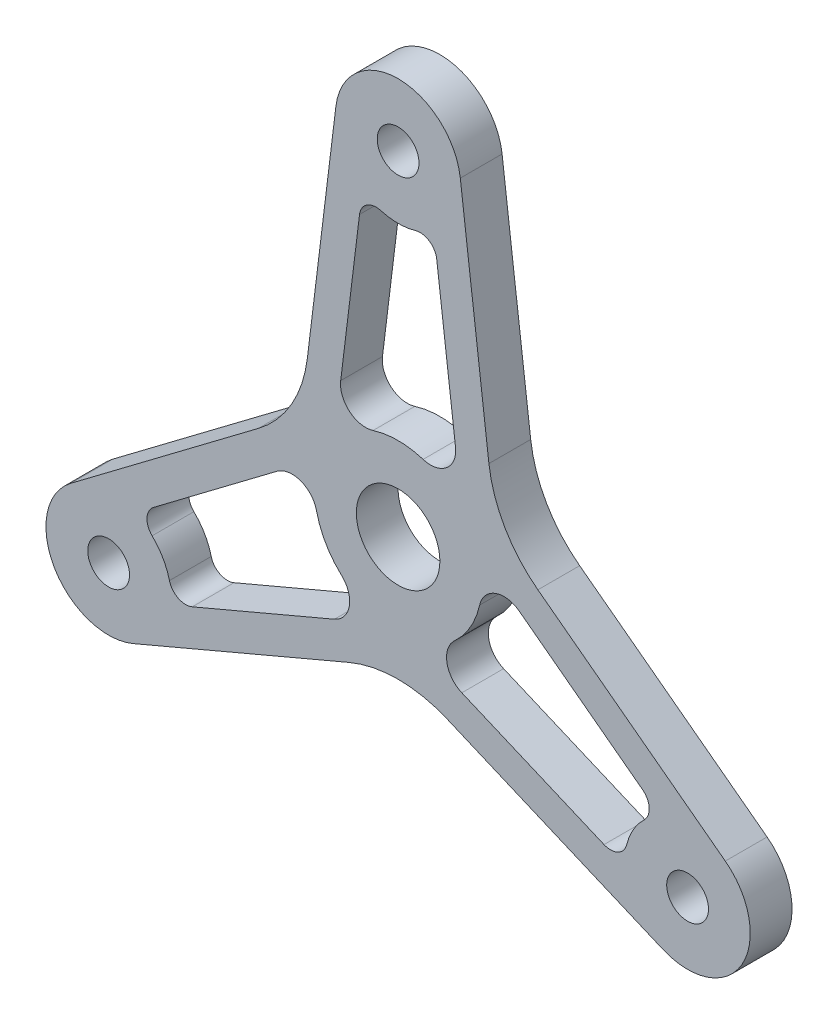
from build123d import *

# Parameters (mm, degrees)
SKETCH1_R           = 5
SKETCH1_R_2         = 10
BOSS_EXTRUDE1_DEPTH = 10


with BuildPart() as part:
    # Sketch1 → Boss-Extrude1 (new body)
    with BuildSketch(Plane.XY):
        with BuildLine():
            ThreePointArc((-33.454782287, 5.779804226), (-25.528470868, 14.738869527), (-21.732848432, 26.082789225))
            Line((-21.732848432, 26.082789225), (-14.888192275, 81.828040151))
            ThreePointArc((-14.888192275, 81.828040151), (0, 95), (14.888192275, 81.828040151))
            Line((14.888192275, 81.828040151), (21.732848432, 26.082789225))
            ThreePointArc((21.732848432, 26.082789225), (25.528470868, 14.738869527), (33.454782287, 5.779804226))
            Line((33.454782287, 5.779804226), (78.30925765, -28.020467349))
            ThreePointArc((78.30925765, -28.020467349), (82.27241336, -47.5), (63.421065375, -53.807572802))
            Line((63.421065375, -53.807572802), (11.721933855, -31.862593451))
            ThreePointArc((11.721933855, -31.862593451), (0, -29.477739055), (-11.721933855, -31.862593451))
            Line((-11.721933855, -31.862593451), (-63.421065375, -53.807572802))
            ThreePointArc((-63.421065375, -53.807572802), (-82.27241336, -47.5), (-78.30925765, -28.020467349))
            Line((-78.30925765, -28.020467349), (-33.454782287, 5.779804226))
        make_face()
        with Locations((-69.282032303, -40)):
            Circle(SKETCH1_R, mode=Mode.SUBTRACT)
        with Locations((69.282032303, -40)):
            Circle(SKETCH1_R, mode=Mode.SUBTRACT)
        with Locations((0, 80)):
            Circle(SKETCH1_R, mode=Mode.SUBTRACT)
        Circle(SKETCH1_R_2, mode=Mode.SUBTRACT)
        with BuildLine():
            ThreePointArc((-4.155876324, 65.587203881), (-7.469391302, 65.0809662), (-9.234294617, 62.231268956))
            Line((-9.234294617, 62.231268956), (-13.739592483, 25.538562373))
            ThreePointArc((-13.739592483, 25.538562373), (-11.624113874, 20.196928868), (-5.987935057, 19.082574086))
            ThreePointArc((-5.987935057, 19.082574086), (0, 20), (5.987935057, 19.082574086))
            ThreePointArc((5.987935057, 19.082574086), (11.624113874, 20.196928868), (13.739592483, 25.538562373))
            Line((13.739592483, 25.538562373), (9.234294617, 62.231268956))
            ThreePointArc((9.234294617, 62.231268956), (7.469391302, 65.0809662), (4.155876324, 65.587203881))
            ThreePointArc((4.155876324, 65.587203881), (0, 65), (-4.155876324, 65.587203881))
        make_face(mode=Mode.SUBTRACT)
        with BuildLine():
            ThreePointArc((58.878122886, -29.194507469), (60.096465683, -26.071800482), (58.511007134, -23.118500753))
            Line((58.511007134, -23.118500753), (28.986840033, -0.870445058))
            ThreePointArc((28.986840033, -0.870445058), (23.303110415, -0.031686522), (19.519961457, -4.355583168))
            ThreePointArc((19.519961457, -4.355583168), (17.320508076, -10), (13.5320264, -14.726990918))
            ThreePointArc((13.5320264, -14.726990918), (11.678996541, -20.165242346), (15.247247549, -24.668117315))
            Line((15.247247549, -24.668117315), (49.276712517, -39.112768202))
            ThreePointArc((49.276712517, -39.112768202), (52.627074381, -39.009165718), (54.722246562, -36.392696412))
            ThreePointArc((54.722246562, -36.392696412), (56.291651246, -32.5), (58.878122886, -29.194507469))
        make_face(mode=Mode.SUBTRACT)
        with BuildLine():
            ThreePointArc((-54.722246562, -36.392696412), (-52.627074381, -39.009165718), (-49.276712517, -39.112768202))
            Line((-49.276712517, -39.112768202), (-15.247247549, -24.668117315))
            ThreePointArc((-15.247247549, -24.668117315), (-11.678996541, -20.165242346), (-13.5320264, -14.726990918))
            ThreePointArc((-13.5320264, -14.726990918), (-17.320508076, -10), (-19.519961457, -4.355583168))
            ThreePointArc((-19.519961457, -4.355583168), (-23.303110415, -0.031686522), (-28.986840033, -0.870445058))
            Line((-28.986840033, -0.870445058), (-58.511007134, -23.118500753))
            ThreePointArc((-58.511007134, -23.118500753), (-60.096465683, -26.071800482), (-58.878122886, -29.194507469))
            ThreePointArc((-58.878122886, -29.194507469), (-56.291651246, -32.5), (-54.722246562, -36.392696412))
        make_face(mode=Mode.SUBTRACT)
    extrude(amount=BOSS_EXTRUDE1_DEPTH)


solid = part.part
